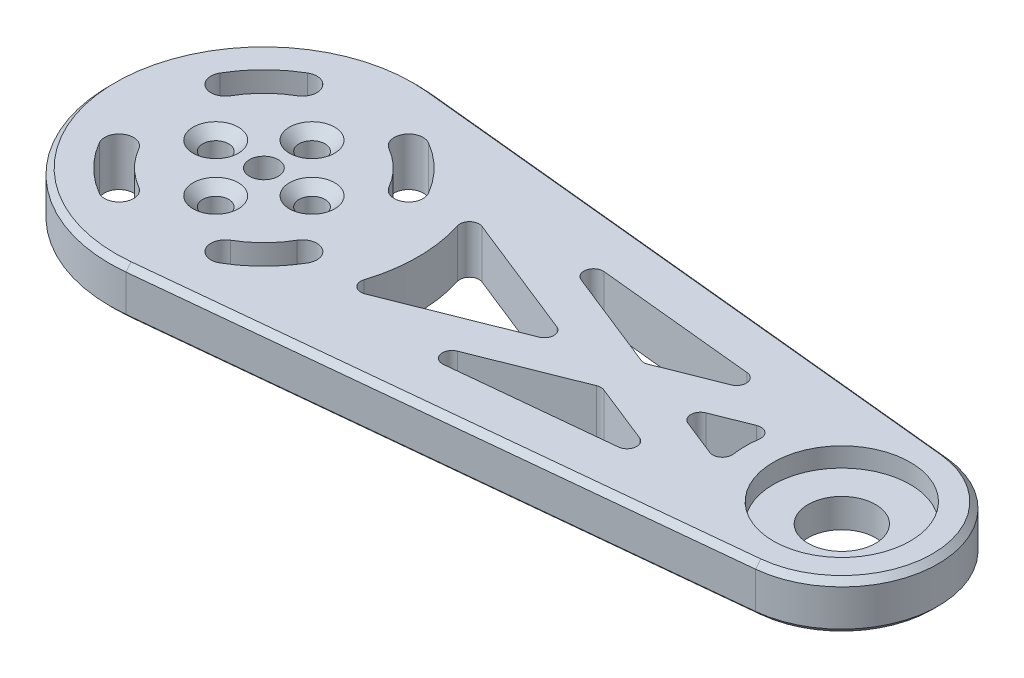
from build123d import *

# Parameters (mm, degrees)
SKETCH_1_R      = 1.35
SKETCH_1_R_2    = 1.5
SKETCH_1_R_3    = 7.1
EXTRUDE_1_DEPTH = 5
SKETCH_1_3_R    = 7.1
SKETCH_1_3_R_2  = 3.5
EXTRUDE_2_DEPTH = 3
FILLET_1_R      = 1
CHAMFER_1_SIZE  = 0.6
CHAMFER_2_SIZE  = 1


with BuildPart() as part:
    # 草图1 → 凸台-拉伸1 (new body)
    with BuildSketch(Plane(origin=(0, 0, 0), x_dir=(1, 0, 0), z_dir=(0, 1, 0))):
        with BuildLine():
            ThreePointArc((1.6, 15.919798994), (-16, 0), (1.6, -15.919798994))
            Line((1.6, -15.919798994), (61, -9.949874371))
            ThreePointArc((61, -9.949874371), (70, 0), (61, 9.949874371))
            Line((61, 9.949874371), (1.6, 15.919798994))
        make_face()
        with BuildLine():
            ThreePointArc((-6.268918397, -10.814372942), (-8.838834765, -8.838834765), (-10.814372942, -6.268918397))
            ThreePointArc((-10.814372942, -6.268918397), (-10.268918397, -4.218923436), (-8.218923436, -4.764377982))
            ThreePointArc((-8.218923436, -4.764377982), (-6.717514421, -6.717514421), (-4.764377982, -8.218923436))
            ThreePointArc((-4.764377982, -8.218923436), (-4.218923436, -10.268918397), (-6.268918397, -10.814372942))
        make_face(mode=Mode.SUBTRACT)
        with Locations((0, -5)):
            Circle(SKETCH_1_R, mode=Mode.SUBTRACT)
        with BuildLine():
            ThreePointArc((10.814372942, -6.268918397), (8.838834765, -8.838834765), (6.268918397, -10.814372942))
            ThreePointArc((6.268918397, -10.814372942), (4.218923436, -10.268918397), (4.764377982, -8.218923436))
            ThreePointArc((4.764377982, -8.218923436), (6.717514421, -6.717514421), (8.218923436, -4.764377982))
            ThreePointArc((8.218923436, -4.764377982), (10.268918397, -4.218923436), (10.814372942, -6.268918397))
        make_face(mode=Mode.SUBTRACT)
        with BuildLine():
            ThreePointArc((14.422056339, -6.928512895), (16, 0), (14.422056339, 6.928512895))
            Line((14.422056339, 6.928512895), (31.815454695, 0))
            Line((31.815454695, 0), (14.422056339, -6.928512895))
        make_face(mode=Mode.SUBTRACT)
        Polygon((47.567517096, -6.274700622), (19.888927579, -9.056503536), (37.219953316, -2.152836244), align=None, mode=Mode.SUBTRACT)
        with Locations((-5, 0)):
            Circle(SKETCH_1_R, mode=Mode.SUBTRACT)
        Circle(SKETCH_1_R_2, mode=Mode.SUBTRACT)
        with Locations((5, 0)):
            Circle(SKETCH_1_R, mode=Mode.SUBTRACT)
        with BuildLine():
            ThreePointArc((-10.814372942, 6.268918397), (-8.838834765, 8.838834765), (-6.268918397, 10.814372942))
            ThreePointArc((-6.268918397, 10.814372942), (-4.218923436, 10.268918397), (-4.764377982, 8.218923436))
            ThreePointArc((-4.764377982, 8.218923436), (-6.717514421, 6.717514421), (-8.218923436, 4.764377982))
            ThreePointArc((-8.218923436, 4.764377982), (-10.268918397, 4.218923436), (-10.814372942, 6.268918397))
        make_face(mode=Mode.SUBTRACT)
        with Locations((0, 5)):
            Circle(SKETCH_1_R, mode=Mode.SUBTRACT)
        with BuildLine():
            ThreePointArc((6.268918397, 10.814372942), (8.838834765, 8.838834765), (10.814372942, 6.268918397))
            ThreePointArc((10.814372942, 6.268918397), (10.268918397, 4.218923436), (8.218923436, 4.764377982))
            ThreePointArc((8.218923436, 4.764377982), (6.717514421, 6.717514421), (4.764377982, 8.218923436))
            ThreePointArc((4.764377982, 8.218923436), (4.218923436, 10.268918397), (6.268918397, 10.814372942))
        make_face(mode=Mode.SUBTRACT)
        with BuildLine():
            Line((50.505563121, -3.139373879), (42.624451937, 0))
            Line((42.624451937, 0), (50.505563121, 3.139373879))
            ThreePointArc((50.505563121, 3.139373879), (50, 0), (50.505563121, -3.139373879))
        make_face(mode=Mode.SUBTRACT)
        Polygon((37.219953316, 2.152836244), (19.888927579, 9.056503536), (47.567517096, 6.274700622), align=None, mode=Mode.SUBTRACT)
        with Locations((60, 0)):
            Circle(SKETCH_1_R_3, mode=Mode.SUBTRACT)
    extrude(amount=EXTRUDE_1_DEPTH)

    # 草图1<3> → 凸台-拉伸2 (add)
    with BuildSketch(Plane(origin=(0, 0, 0), x_dir=(1, 0, 0), z_dir=(0, 1, 0))):
        with Locations((60, 0)):
            Circle(SKETCH_1_3_R)
        with Locations((60, 0)):
            Circle(SKETCH_1_3_R_2, mode=Mode.SUBTRACT)
    extrude(amount=EXTRUDE_2_DEPTH)

    # 圆角1
    fillet_1_edges = [part.edges().sort_by_distance(p)[0] for p in [
        (42.624451937, 2.5, 0),
        (50.505563121, 2.5, -3.139373879),
        (50.505563121, 2.5, 3.139373879),
        (47.567517096, 2.5, -6.274700622),
        (19.888927579, 2.5, -9.056503536),
        (37.219953316, 2.5, -2.152836244),
        (31.815454695, 2.5, 0),
        (14.422056339, 2.5, -6.928512895),
        (14.422056339, 2.5, 6.928512895),
        (19.888927579, 2.5, 9.056503536),
        (37.219953316, 2.5, 2.152836244),
        (47.567517096, 2.5, 6.274700622),
    ]]
    fillet(fillet_1_edges, radius=FILLET_1_R)

    # 倒角1
    chamfer_1_edges = [part.edges().sort_by_distance(p)[0] for p in [
        (31.3, 5, 12.934836682),
        (-16, 5, 0),
        (70, 5, 0),
        (31.3, 5, -12.934836682),
        (31.3, 0, 12.934836682),
        (-16, 0, 0),
        (70, 0, 0),
        (31.3, 0, -12.934836682),
    ]]
    chamfer(chamfer_1_edges, length=CHAMFER_1_SIZE)

    # 倒角2
    chamfer_2_edges = [part.edges().sort_by_distance(p)[0] for p in [
        (-6.35, 5, 0),
        (-1.35, 5, 5),
        (3.65, 5, 0),
        (-1.35, 5, -5),
    ]]
    chamfer(chamfer_2_edges, length=CHAMFER_2_SIZE)


solid = part.part
